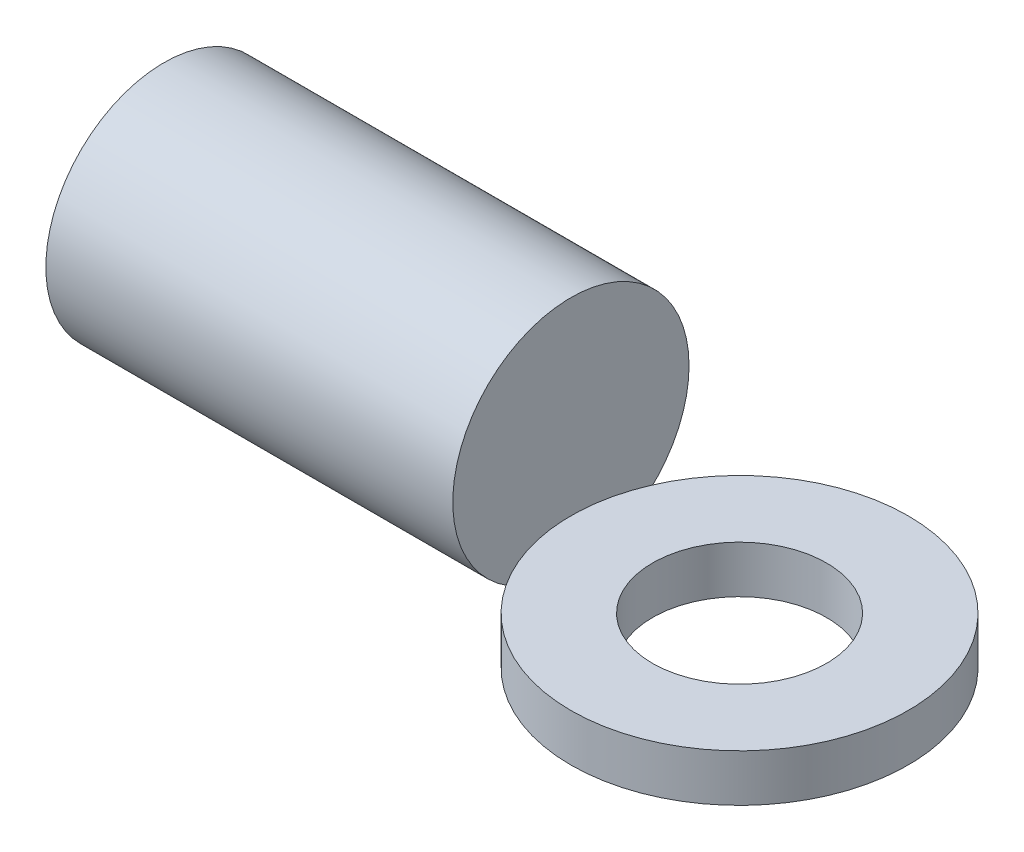
from build123d import *

# Parameters (mm, degrees)
SKETCH18_R          = 2.5
BOSS_EXTRUDE4_DEPTH = 8.6113
SKETCH1_R           = 1.8415
BOSS_EXTRUDE5_DEPTH = 1


with BuildPart() as part:
    # Sketch18 → Boss-Extrude4 (new body)
    with BuildSketch(Plane(origin=(-12.18, 0, 0), x_dir=(0, 0, -1), z_dir=(1, 0, 0))):
        with Locations((0, 2.5)):
            Circle(SKETCH18_R)
    extrude(amount=BOSS_EXTRUDE4_DEPTH)


with BuildPart() as body_2:
    # Sketch1 → Boss-Extrude5 (new body)
    with BuildSketch(Plane(origin=(0, 0, 0), x_dir=(1, 0, 0), z_dir=(0, 1, 0))):
        with BuildLine():
            ThreePointArc((-2.114236195, -2.875), (3.5687, 0), (-2.114236195, 2.875))
            ThreePointArc((-2.114236195, 2.875), (-3.5687, 0), (-2.114236195, -2.875))
        make_face()
        with Locations(Location((0, 0, 0), (0, 0, 270))):
            Circle(SKETCH1_R, mode=Mode.SUBTRACT)
    extrude(amount=BOSS_EXTRUDE5_DEPTH)


solid = Compound([part.part, body_2.part])
